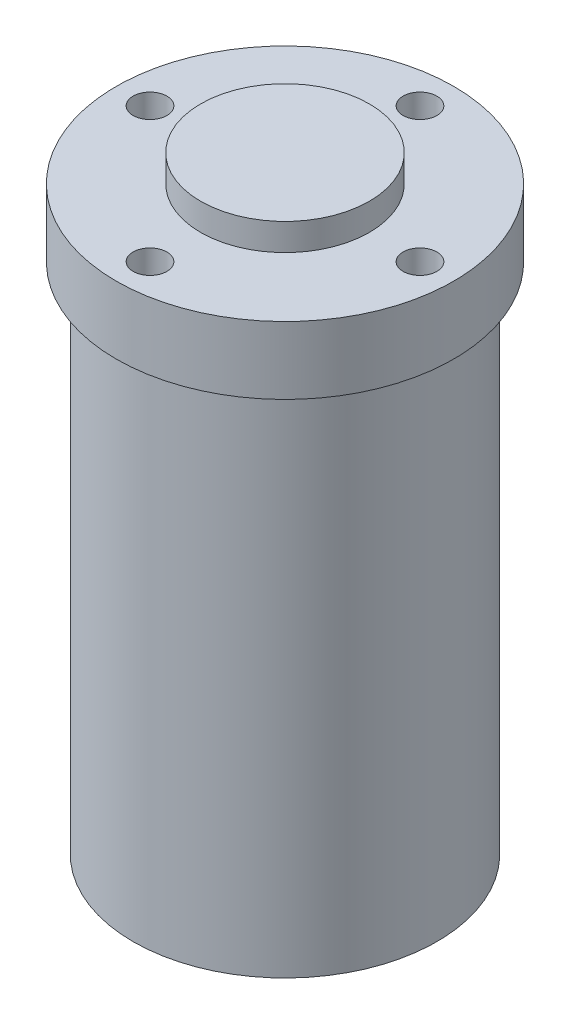
from build123d import *

# Parameters (mm, degrees)
SKETCH1_R           = 22.5
BOSS_EXTRUDE1_DEPTH = 76
SKETCH2_R           = 25
BOSS_EXTRUDE2_DEPTH = 10
SKETCH3_R           = 12.5
BOSS_EXTRUDE3_DEPTH = 4
SKETCH4_R           = 2.5
CUT_EXTRUDE1_DEPTH  = 8
CIRPATTERN1_COUNT   = 4
SKETCH5_R           = 2.5
CUT_EXTRUDE2_DEPTH  = 8
CIRPATTERN2_COUNT   = 5


with BuildPart() as part:
    # Sketch1 → Boss-Extrude1 (new body)
    with BuildSketch(Plane(origin=(0, 0, 0), x_dir=(1, 0, 0), z_dir=(0, 1, 0))):
        with Locations(Location((0, 0, 0), (0, 0, 270))):
            Circle(SKETCH1_R)
    extrude(amount=BOSS_EXTRUDE1_DEPTH)

    # Sketch2 → Boss-Extrude2 (add)
    with BuildSketch(Plane(origin=(0, 76, 0), x_dir=(1, 0, 0), z_dir=(0, 1, 0))):
        with Locations(Location((0, 0, 0), (0, 0, 270))):
            Circle(SKETCH2_R)
    extrude(amount=BOSS_EXTRUDE2_DEPTH)

    # Sketch3 → Boss-Extrude3 (add)
    with BuildSketch(Plane(origin=(0, 86, 0), x_dir=(1, 0, 0), z_dir=(0, 1, 0))):
        with Locations(Location((0, 0, 0), (0, 0, 270))):
            Circle(SKETCH3_R)
    extrude(amount=BOSS_EXTRUDE3_DEPTH)

    # Sketch4 → Cut-Extrude1 (cut)
    with BuildSketch(Plane(origin=(0, 86, 0), x_dir=(1, 0, 0), z_dir=(0, 1, 0))):
        with Locations(Location((-20, 0, 0), (0, 0, 270))):
            Circle(SKETCH4_R)
    cut_extrude1 = extrude(amount=-CUT_EXTRUDE1_DEPTH, mode=Mode.SUBTRACT)

    # CirPattern1: Cut-Extrude1 ×4 about axis
    cirpattern1_axis = Axis((0, 0, 0), (0, 1, 0))
    for i in range(1, CIRPATTERN1_COUNT):
        add(cut_extrude1.rotate(cirpattern1_axis, i * 360 / CIRPATTERN1_COUNT), mode=Mode.SUBTRACT)

    # Sketch5 → Cut-Extrude2 (cut)
    with BuildSketch(Plane.XZ):
        with Locations(Location((0, 17.5, 0), (0, 0, 270))):
            Circle(SKETCH5_R)
    cut_extrude2 = extrude(amount=-CUT_EXTRUDE2_DEPTH, mode=Mode.SUBTRACT)

    # CirPattern2: Cut-Extrude2 ×5 about axis
    cirpattern2_axis = Axis((0, 0, 0), (0, 1, 0))
    for i in range(1, CIRPATTERN2_COUNT):
        add(cut_extrude2.rotate(cirpattern2_axis, i * 360 / CIRPATTERN2_COUNT), mode=Mode.SUBTRACT)


solid = part.part
